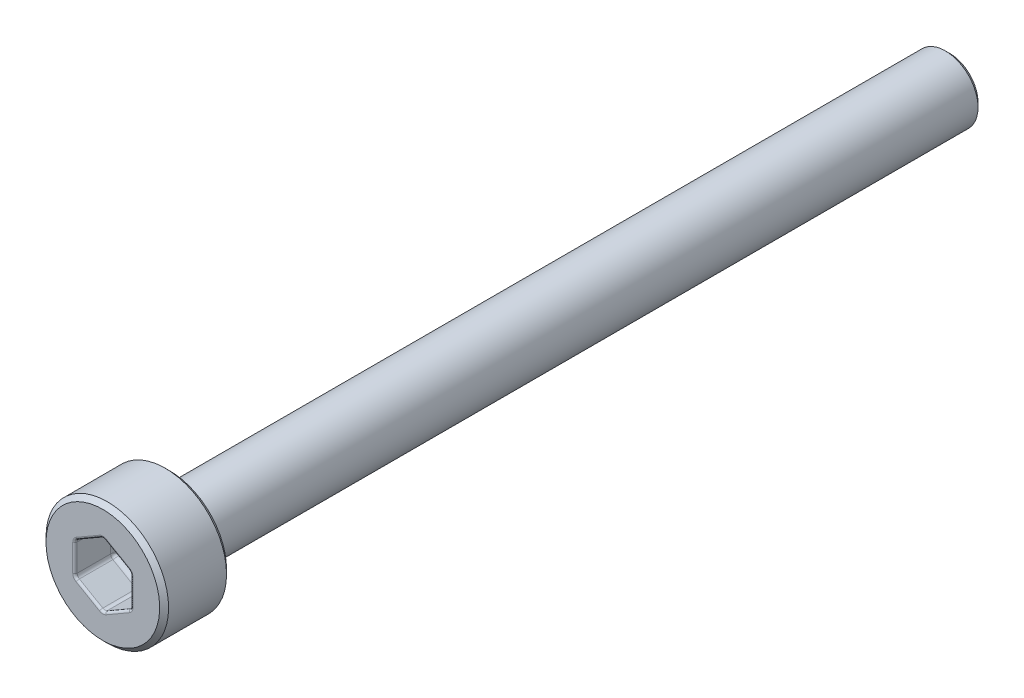
from build123d import *

# Parameters (mm, degrees)
SCHNITT_LINEAR_AUSTRAGEN1_DEPTH = 1.8
FASE1_SIZE                      = 0.2
VERRUNDUNG1_R                   = 0.2
VERRUNDUNG2_R                   = 0.1


with BuildPart() as part:
    # Skizze1 → Rotation1 (revolve)
    with BuildSketch(Plane(origin=(0, 0, 0), x_dir=(0, 0, -1), z_dir=(1, 0, 0)), mode=Mode.PRIVATE) as rotation1_sk:
        Polygon((-3, 0), (-3, 2.75), (0, 2.75), (0, 1.465), (35, 1.465), (35, 0), align=None)
    revolve(rotation1_sk.sketch.rotate(Axis((0, 0, 21.919879518), (0, 0, -1)), 90), axis=Axis((0, 0, 21.919879518), (0, 0, -1)))

    # Skizze2 → Schnitt-Linear austragen1 (cut)
    with BuildSketch(Plane.XY.offset(3)):
        Polygon((1.25, -0.721687836), (1.25, 0.721687836), (0, 1.443375673), (-1.25, 0.721687836), (-1.25, -0.721687836), (0, -1.443375673), align=None)
    extrude(amount=-SCHNITT_LINEAR_AUSTRAGEN1_DEPTH, mode=Mode.SUBTRACT)

    # Fase1
    fase1_edges = [part.edges().sort_by_distance(p)[0] for p in [
        (-1.465, 0, -35),
        (-2.75, 0, 0),
        (-2.75, 0, 3),
    ]]
    chamfer(fase1_edges, length=FASE1_SIZE)

    # Verrundung1
    verrundung1_edges = [part.edges().sort_by_distance(p)[0] for p in [
        (0.625, -1.082531755, 1.2),
        (1.25, -0.721687836, 2.1),
        (-0.625, -1.082531755, 1.2),
        (0, -1.443375673, 2.1),
        (-1.25, 0, 1.2),
        (-1.25, -0.721687836, 2.1),
        (-0.625, 1.082531755, 1.2),
        (-1.25, 0.721687836, 2.1),
        (0.625, 1.082531755, 1.2),
        (0, 1.443375673, 2.1),
        (1.25, 0, 1.2),
        (1.25, 0.721687836, 2.1),
        (-1.465, 0, 0),
    ]]
    fillet(verrundung1_edges, radius=VERRUNDUNG1_R)

    # Verrundung2
    verrundung2_edges = [part.edges().sort_by_distance(p)[0] for p in [
        (-0.625, -1.082531755, 3),
        (-1.25, 0, 3),
        (-0.625, 1.082531755, 3),
        (0.625, 1.082531755, 3),
        (1.25, 0, 3),
        (0.625, -1.082531755, 3),
        (-1.223205081, -0.706217783, 3),
        (0, -1.412435565, 3),
        (1.223205081, -0.706217783, 3),
        (1.223205081, 0.706217783, 3),
        (0, 1.412435565, 3),
        (-1.223205081, 0.706217783, 3),
    ]]
    fillet(verrundung2_edges, radius=VERRUNDUNG2_R)


solid = part.part
